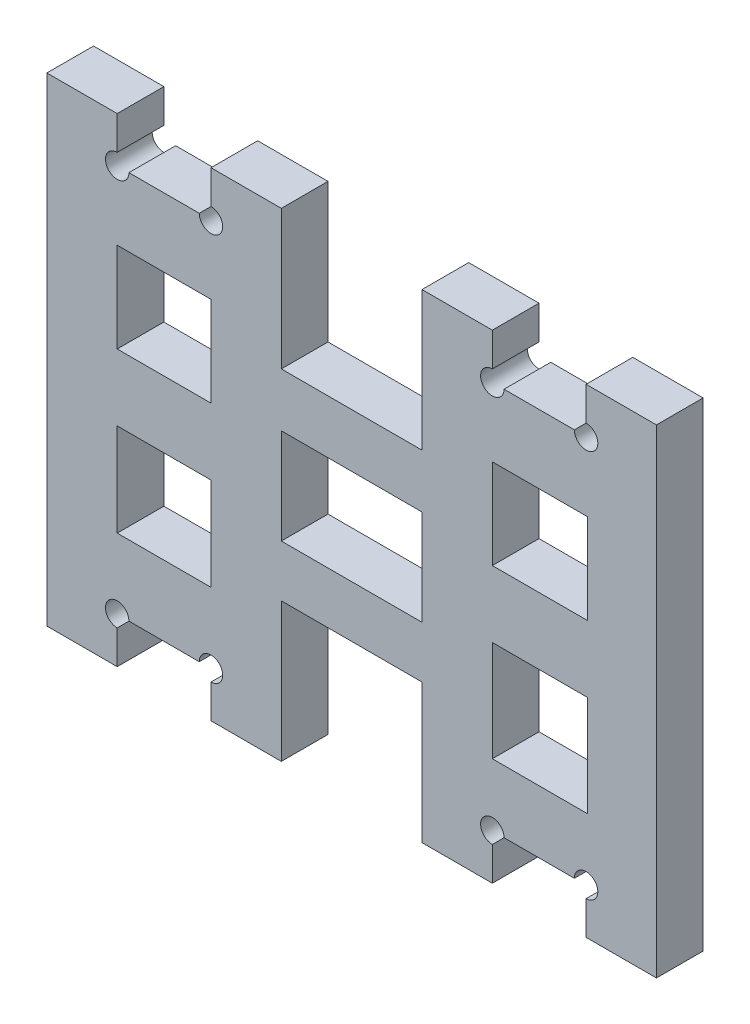
from build123d import *

# Parameters (mm, degrees)
SKETCH_1_W      = 4.017465015
SKETCH_1_H      = 3.978187255
SKETCH_1_W_2    = 4.077802358
SKETCH_1_H_2    = 4.314220686
SKETCH_1_H_3    = 3.850544283
SKETCH_1_W_3    = 6.026196403
SKETCH_1_H_4    = 4.091203301
EXTRUDE_1_DEPTH = 2


with BuildPart() as part:
    # 草图1 → 凸台-拉伸1 (new body)
    with BuildSketch(Plane.XY):
        with BuildLine():
            Line((-3.013099113, 5.02), (-6.026197287, 5.02))
            Line((-6.026197287, 5.02), (-6.026197287, 3.58112561))
            ThreePointArc((-6.026197287, 3.58112561), (-5.671102411, 2.723845564), (-6.528380473, 3.07894523))
            Line((-6.528380473, 3.07894523), (-9.541479116, 3.07894523))
            ThreePointArc((-9.541479116, 3.07894523), (-10.398757348, 2.723845394), (-10.043662302, 3.58112561))
            Line((-10.043662302, 3.58112561), (-10.043662302, 5.02))
            Line((-10.043662302, 5.02), (-13.056760945, 5.02))
            Line((-13.056760945, 5.02), (-13.056760945, -15.5))
            Line((-13.056760945, -15.5), (-10.043662302, -15.5))
            Line((-10.043662302, -15.5), (-10.043662302, -14.061127012))
            ThreePointArc((-10.043662302, -14.061127012), (-10.398759363, -13.203846763), (-9.541479117, -13.558943832))
            Line((-9.541479117, -13.558943832), (-6.528380473, -13.558943832))
            ThreePointArc((-6.528380473, -13.558943832), (-5.67110042, -13.203846836), (-6.026197287, -14.061126942))
            Line((-6.026197287, -14.061126942), (-6.026197287, -15.5))
            Line((-6.026197287, -15.5), (-3.013099112, -15.5))
            Line((-3.013099112, -15.5), (-3.013099112, -9.541477971))
            Line((-3.013099112, -9.541477971), (3.013099113, -9.541477971))
            Line((3.013099113, -9.541477971), (3.013099113, -15.5))
            Line((3.013099113, -15.5), (6.02619635, -15.5))
            Line((6.02619635, -15.5), (6.02619635, -14.061126942))
            ThreePointArc((6.02619635, -14.061126942), (5.671100318, -13.20384612), (6.528380473, -13.558943762))
            Line((6.528380473, -13.558943762), (9.541479585, -13.558943762))
            ThreePointArc((9.541479585, -13.558943762), (10.398760105, -13.203847022), (10.043661834, -14.061126908))
            Line((10.043661834, -14.061126908), (10.043661834, -15.5))
            Line((10.043661834, -15.5), (13.056760946, -15.5))
            Line((13.056760946, -15.5), (13.056760946, 5.02))
            Line((13.056760946, 5.02), (10.043661833, 5.02))
            Line((10.043661833, 5.02), (10.043661833, 3.58112561))
            ThreePointArc((10.043661833, 3.58112561), (10.398758101, 2.723845772), (9.541479585, 3.07894523))
            Line((9.541479585, 3.07894523), (6.528380474, 3.07894523))
            ThreePointArc((6.528380474, 3.07894523), (5.671102333, 2.723844823), (6.026196353, 3.58112561))
            Line((6.026196353, 3.58112561), (6.026196353, 5.02))
            Line((6.026196353, 5.02), (3.013099113, 5.02))
            Line((3.013099113, 5.02), (3.013099113, -0.938521958))
            Line((3.013099113, -0.938521958), (-3.013099113, -0.938521958))
            Line((-3.013099113, -0.938521958), (-3.013099113, 5.02))
        make_face()
        with Locations((-8.034929795, -8.556751552)):
            Rectangle(SKETCH_1_W, SKETCH_1_H, mode=Mode.SUBTRACT)
        with Locations((8.06509753, -8.724768268)):
            Rectangle(SKETCH_1_W_2, SKETCH_1_H_2, mode=Mode.SUBTRACT)
        with Locations((8.06509753, -1.788857431)):
            Rectangle(SKETCH_1_W_2, SKETCH_1_H_3, mode=Mode.SUBTRACT)
        with Locations((-4.68e-07, -5.278413187)):
            Rectangle(SKETCH_1_W_3, SKETCH_1_H_4, mode=Mode.SUBTRACT)
        with Locations((-8.034929795, -1.788857431)):
            Rectangle(SKETCH_1_W, SKETCH_1_H_3, mode=Mode.SUBTRACT)
    extrude(amount=EXTRUDE_1_DEPTH)


solid = part.part
